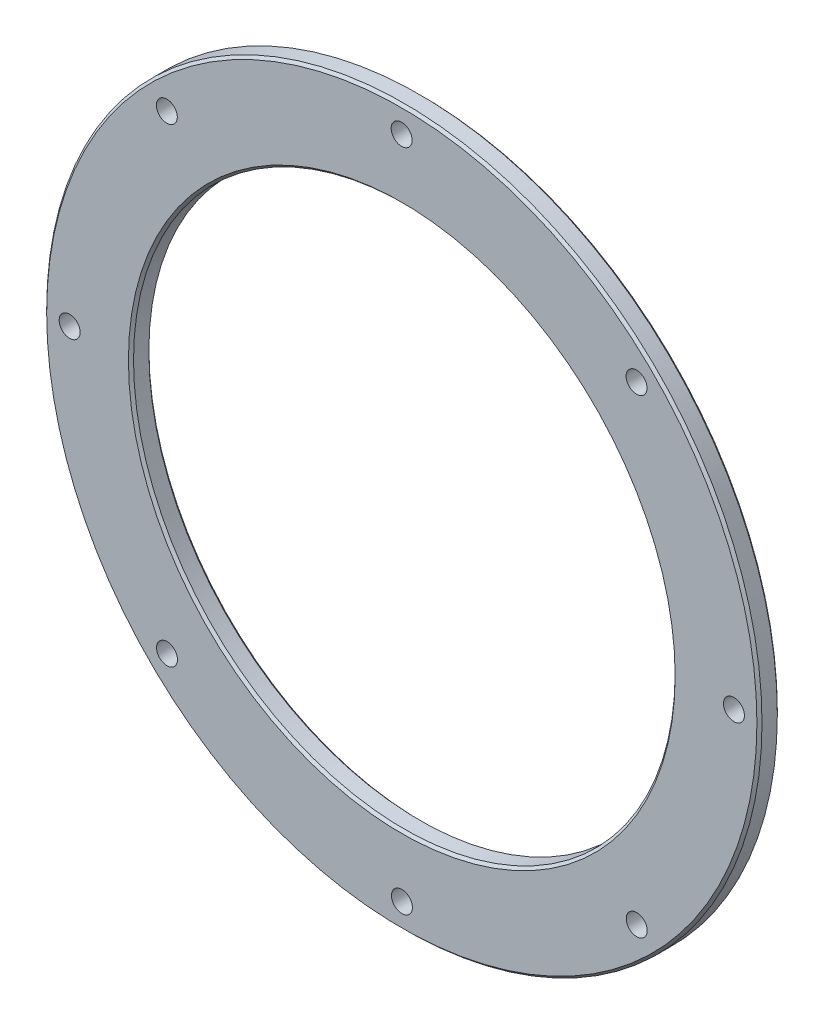
from build123d import *

# Parameters (mm, degrees)
SKETCH1_R           = 140
SKETCH1_R_2         = 4.1
SKETCH1_R_3         = 106
BOSS_EXTRUDE1_DEPTH = 8
CHAMFER2_SIZE       = 1


with BuildPart() as part:
    # Sketch1 → Boss-Extrude1 (new body)
    with BuildSketch(Plane(origin=(0, 0, -8), x_dir=(-1, 0, 0), z_dir=(0, 0, -1))):
        with Locations(Location((0, 0, 0), (0, 0, 180))):
            Circle(SKETCH1_R)
        with Locations(Location((91.960251276, 91.887497437, 0), (0, 0, 180))):
            Circle(SKETCH1_R_2, mode=Mode.SUBTRACT)
        with Locations(Location((129.999989821, -0.051444733, 0), (0, 0, 180))):
            Circle(SKETCH1_R_2, mode=Mode.SUBTRACT)
        with Locations(Location((91.887497437, -91.960251276, 0), (0, 0, 180))):
            Circle(SKETCH1_R_2, mode=Mode.SUBTRACT)
        with Locations(Location((-0.051444733, -129.999989821, 0), (0, 0, 180))):
            Circle(SKETCH1_R_2, mode=Mode.SUBTRACT)
        with Locations(Location((-91.960251276, -91.887497437, 0), (0, 0, 180))):
            Circle(SKETCH1_R_2, mode=Mode.SUBTRACT)
        with Locations(Location((-129.999989821, 0.051444733, 0), (0, 0, 180))):
            Circle(SKETCH1_R_2, mode=Mode.SUBTRACT)
        with Locations(Location((-91.887497437, 91.960251276, 0), (0, 0, 180))):
            Circle(SKETCH1_R_2, mode=Mode.SUBTRACT)
        with Locations(Location((0.051444733, 129.999989821, 0), (0, 0, 180))):
            Circle(SKETCH1_R_2, mode=Mode.SUBTRACT)
        with Locations(Location((0, 0, 0), (0, 0, 180))):
            Circle(SKETCH1_R_3, mode=Mode.SUBTRACT)
    extrude(amount=-BOSS_EXTRUDE1_DEPTH)

    # Chamfer2
    chamfer2_edges = [part.edges().sort_by_distance(p)[0] for p in [
        (-140, 0, -8),
        (-106, 0, 0),
        (-106, 0, -8),
        (-140, 0, 0),
    ]]
    chamfer(chamfer2_edges, length=CHAMFER2_SIZE)


solid = part.part
